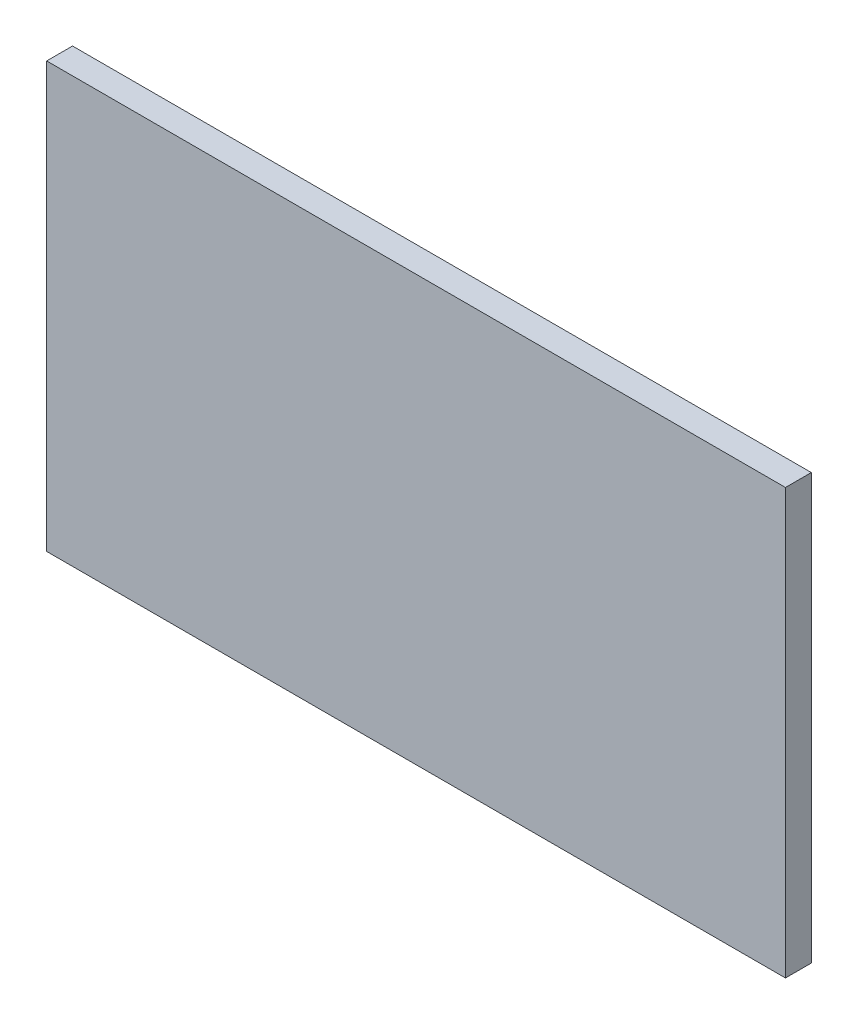
from build123d import *

# Parameters (mm, degrees)
SKETCH1_W           = 508
SKETCH1_H           = 292.1
BOSS_EXTRUDE1_DEPTH = 17.78


with BuildPart() as part:
    # Sketch1 → Boss-Extrude1 (new body)
    with BuildSketch(Plane.XY):
        Rectangle(SKETCH1_W, SKETCH1_H)
    extrude(amount=BOSS_EXTRUDE1_DEPTH)


solid = part.part
